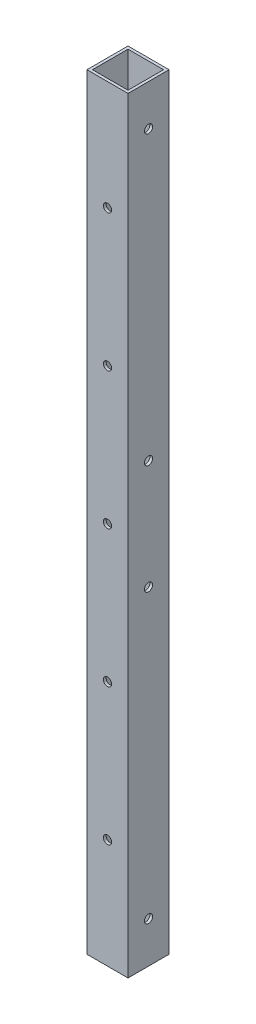
from build123d import *

# Parameters (mm, degrees)
SKETCH_1_W          = 15
SKETCH_1_H          = 15
SKETCH_1_W_2        = 13
SKETCH_1_H_2        = 13
EXTRUDE_1_DEPTH     = 280
SKETCH_2_R          = 1.5
CUT_EXTRUDE_1_DEPTH = 281.501782526
SKETCH_3_R          = 1.5
CUT_EXTRUDE_2_DEPTH = 281.501782526


with BuildPart() as part:
    # 草图1 → 凸台-拉伸1 (new body)
    with BuildSketch(Plane(origin=(0, 0, 0), x_dir=(1, 0, 0), z_dir=(0, 1, 0))):
        Rectangle(SKETCH_1_W, SKETCH_1_H)
        Rectangle(SKETCH_1_W_2, SKETCH_1_H_2, mode=Mode.SUBTRACT)
    extrude(amount=EXTRUDE_1_DEPTH)

    # 草图2 → 切除-拉伸1 (cut, through all)
    with BuildSketch(Plane.XY.offset(7.5)):
        with Locations((0, 40)):
            Circle(SKETCH_2_R)
        with Locations((0, 140)):
            Circle(SKETCH_2_R)
        with Locations((0, 90)):
            Circle(SKETCH_2_R)
        with Locations((0, 240)):
            Circle(SKETCH_2_R)
        with Locations((0, 190)):
            Circle(SKETCH_2_R)
    extrude(amount=-CUT_EXTRUDE_1_DEPTH, mode=Mode.SUBTRACT)

    # 草图3 → 切除-拉伸2 (cut, through all)
    with BuildSketch(Plane(origin=(7.5, 0, 0), x_dir=(0, 0, -1), z_dir=(1, 0, 0))):
        with Locations((0, 160)):
            Circle(SKETCH_3_R)
        with Locations(Location((0, 120, 0), (0, 0, 180))):
            Circle(SKETCH_3_R)
        with Locations((0, 15)):
            Circle(SKETCH_3_R)
        with Locations(Location((0, 265, 0), (0, 0, 180))):
            Circle(SKETCH_3_R)
    extrude(amount=-CUT_EXTRUDE_2_DEPTH, mode=Mode.SUBTRACT)


solid = part.part
